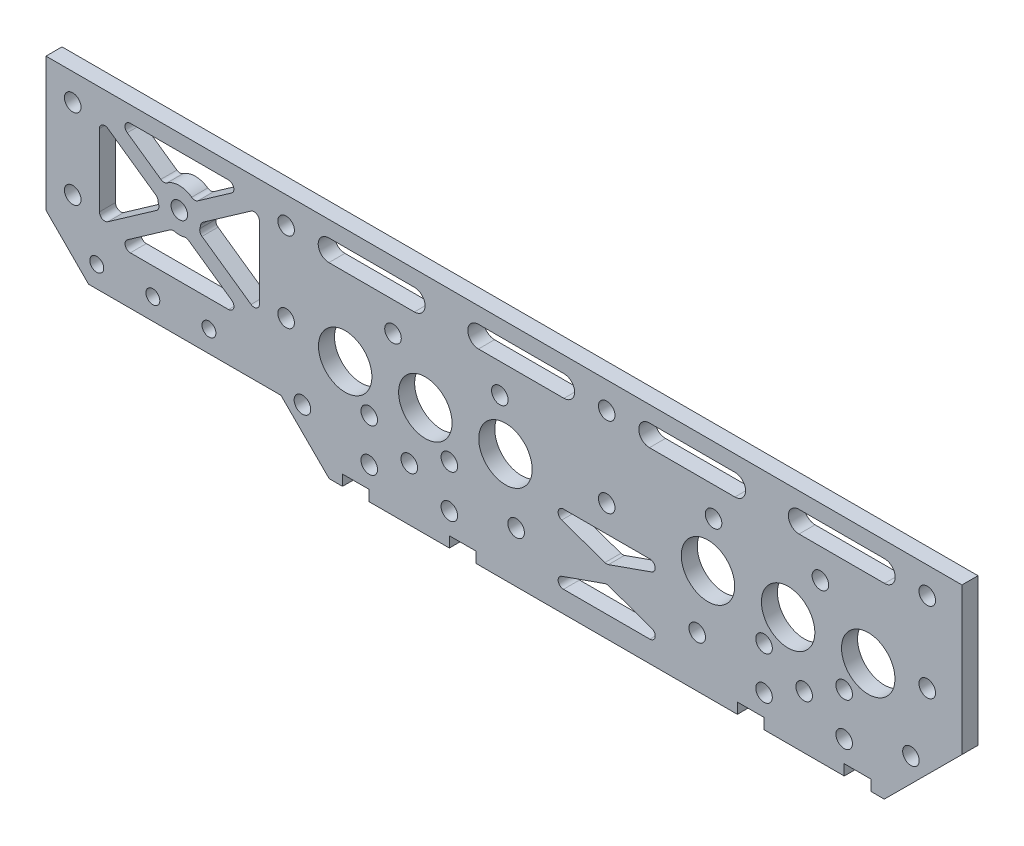
from build123d import *

# Parameters (mm, degrees)
SKETCH_1_R          = 1.55
SKETCH_1_R_2        = 1.3
EXTRUDE_1_DEPTH     = 3
FILLET_1_R          = 1
SKETCH_2_R          = 5
SKETCH_2_R_2        = 1.55
CUT_EXTRUDE_1_DEPTH = 10
SKETCH_3_W          = 5
SKETCH_3_H          = 8
CUT_EXTRUDE_2_DEPTH = 10


with BuildPart() as part:
    # 草图1 → 凸台-拉伸1 (new body)
    with BuildSketch(Plane.XY):
        Polygon((-68, 32), (103.45, 32), (103.45, 7), (103.45, 4.5), (88.907352941, -10), (86.4, -10), (-12.5, -10), (-15, -10), (-24.026470588, -1), (-60.023460411, -1), (-68, 7), align=None)
        with Locations((-7.5, 4)):
            Circle(SKETCH_1_R, mode=Mode.SUBTRACT)
        with Locations((-7.5, -4)):
            Circle(SKETCH_1_R, mode=Mode.SUBTRACT)
        with Locations((7.5, -4)):
            Circle(SKETCH_1_R, mode=Mode.SUBTRACT)
        with Locations((7.5, 4)):
            Circle(SKETCH_1_R, mode=Mode.SUBTRACT)
        with Locations((66.4, 4)):
            Circle(SKETCH_1_R, mode=Mode.SUBTRACT)
        with Locations((66.4, -4)):
            Circle(SKETCH_1_R, mode=Mode.SUBTRACT)
        with Locations((81.4, 4)):
            Circle(SKETCH_1_R, mode=Mode.SUBTRACT)
        with Locations((81.4, -4)):
            Circle(SKETCH_1_R, mode=Mode.SUBTRACT)
        with Locations((-63, 27)):
            Circle(SKETCH_1_R, mode=Mode.SUBTRACT)
        with Locations((-63, 12)):
            Circle(SKETCH_1_R, mode=Mode.SUBTRACT)
        with Locations((16.95, 19.5)):
            Circle(SKETCH_1_R, mode=Mode.SUBTRACT)
        with Locations((-3.05, 19.5)):
            Circle(SKETCH_1_R, mode=Mode.SUBTRACT)
        with Locations((-23.05, 27)):
            Circle(SKETCH_1_R, mode=Mode.SUBTRACT)
        with Locations((-23.05, 12)):
            Circle(SKETCH_1_R, mode=Mode.SUBTRACT)
        with Locations((36.95, 27)):
            Circle(SKETCH_1_R, mode=Mode.SUBTRACT)
        with Locations((36.95, 12)):
            Circle(SKETCH_1_R, mode=Mode.SUBTRACT)
        with Locations((56.95, 19.5)):
            Circle(SKETCH_1_R, mode=Mode.SUBTRACT)
        with Locations((76.95, 19.5)):
            Circle(SKETCH_1_R, mode=Mode.SUBTRACT)
        with Locations((96.95, 27)):
            Circle(SKETCH_1_R, mode=Mode.SUBTRACT)
        with Locations((96.95, 12)):
            Circle(SKETCH_1_R, mode=Mode.SUBTRACT)
        with Locations((-48, 3)):
            Circle(SKETCH_1_R_2, mode=Mode.SUBTRACT)
        with Locations((-37.5, 3)):
            Circle(SKETCH_1_R_2, mode=Mode.SUBTRACT)
        with Locations((-58.5, 3)):
            Circle(SKETCH_1_R_2, mode=Mode.SUBTRACT)
        with Locations((-43.05, 19.5)):
            Circle(SKETCH_1_R, mode=Mode.SUBTRACT)
        with Locations((93.9, -0.5)):
            Circle(SKETCH_1_R, mode=Mode.SUBTRACT)
        with Locations(Location((53.9, -0.5, 0), (0, 0, 180))):
            Circle(SKETCH_1_R, mode=Mode.SUBTRACT)
        with Locations(Location((-20, -0.5, 0), (0, 0, 180))):
            Circle(SKETCH_1_R, mode=Mode.SUBTRACT)
        with Locations((20, -0.5)):
            Circle(SKETCH_1_R, mode=Mode.SUBTRACT)
        with BuildLine():
            Line((-15.05, 29), (0.95, 29))
            ThreePointArc((0.95, 29), (2.95, 27), (0.95, 25))
            Line((0.95, 25), (-15.05, 25))
            ThreePointArc((-15.05, 25), (-17.05, 27), (-15.05, 29))
        make_face(mode=Mode.SUBTRACT)
        with BuildLine():
            Line((12.95, 29), (28.95, 29))
            ThreePointArc((28.95, 29), (30.95, 27), (28.95, 25))
            Line((28.95, 25), (12.95, 25))
            ThreePointArc((12.95, 25), (10.95, 27), (12.95, 29))
        make_face(mode=Mode.SUBTRACT)
        with BuildLine():
            Line((44.95, 29), (60.95, 29))
            ThreePointArc((60.95, 29), (62.95, 27), (60.95, 25))
            Line((60.95, 25), (44.95, 25))
            ThreePointArc((44.95, 25), (42.95, 27), (44.95, 29))
        make_face(mode=Mode.SUBTRACT)
        with BuildLine():
            Line((72.95, 29), (88.95, 29))
            ThreePointArc((88.95, 29), (90.95, 27), (88.95, 25))
            Line((88.95, 25), (72.95, 25))
            ThreePointArc((72.95, 25), (70.95, 27), (72.95, 29))
        make_face(mode=Mode.SUBTRACT)
        with BuildLine():
            Line((-30.662765464, 29), (-40.203557385, 22.310296148))
            ThreePointArc((-40.203557385, 22.310296148), (-43.03543461, 23.499973481), (-45.875900736, 22.330951259))
            Line((-45.875900736, 22.330951259), (-55.387234536, 29))
            Line((-55.387234536, 29), (-30.662765464, 29))
        make_face(mode=Mode.SUBTRACT)
        with BuildLine():
            Line((-55.387234536, 8), (-44.370821033, 15.724363392))
            ThreePointArc((-44.370821033, 15.724363392), (-43.032385745, 15.500038783), (-41.695978002, 15.736142347))
            Line((-41.695978002, 15.736142347), (-30.662765464, 8))
            Line((-30.662765464, 8), (-55.387234536, 8))
        make_face(mode=Mode.SUBTRACT)
        with BuildLine():
            Line((-58, 27.16801086), (-47.04998801, 19.490206126))
            ThreePointArc((-47.04998801, 19.490206126), (-46.950749965, 18.614477719), (-46.662143081, 17.781738565))
            Line((-46.662143081, 17.781738565), (-58, 9.83198914))
            Line((-58, 9.83198914), (-58, 27.16801086))
        make_face(mode=Mode.SUBTRACT)
        with BuildLine():
            Line((-39.425439217, 17.808090093), (-28.05, 9.83198914))
            Line((-28.05, 9.83198914), (-28.05, 27.16801086))
            Line((-28.05, 27.16801086), (-39.050253376, 19.454978443))
            ThreePointArc((-39.050253376, 19.454978443), (-39.149926133, 18.611504738), (-39.425439217, 17.808090093))
        make_face(mode=Mode.SUBTRACT)
        Polygon((23.014193592, -6), (36.95, -1.090366306), (50.885806408, -6), align=None, mode=Mode.SUBTRACT)
        Polygon((23.014193592, 7), (36.95, 2.090366306), (50.885806408, 7), align=None, mode=Mode.SUBTRACT)
    extrude(amount=EXTRUDE_1_DEPTH)

    # 圆角1
    fillet_1_edges = [part.edges().sort_by_distance(p)[0] for p in [
        (-30.662765464, 29, 1.5),
        (-55.387234536, 29, 1.5),
        (-45.875900736, 22.330951259, 1.5),
        (-40.203557385, 22.310296148, 1.5),
        (-55.387234536, 8, 1.5),
        (-30.662765464, 8, 1.5),
        (-41.695978002, 15.736142347, 1.5),
        (-44.370821033, 15.724363392, 1.5),
        (-58, 27.16801086, 1.5),
        (-58, 9.83198914, 1.5),
        (-46.662143081, 17.781738565, 1.5),
        (-47.04998801, 19.490206126, 1.5),
        (-28.05, 9.83198914, 1.5),
        (-28.05, 27.16801086, 1.5),
        (-39.050253376, 19.454978443, 1.5),
        (-39.425439217, 17.808090093, 1.5),
        (50.885806408, 7, 1.5),
        (23.014193592, 7, 1.5),
        (36.95, 2.090366306, 1.5),
        (23.014193592, -6, 1.5),
        (50.885806408, -6, 1.5),
        (36.95, -1.090366306, 1.5),
    ]]
    fillet(fillet_1_edges, radius=FILLET_1_R)

    # 草图2 → 切除-拉伸1 (cut)
    with BuildSketch(Plane.XY.offset(3)):
        with Locations((-12, 10.5)):
            Circle(SKETCH_2_R)
        with Locations((3, 10.5)):
            Circle(SKETCH_2_R)
        with Locations((18, 10.5)):
            Circle(SKETCH_2_R)
        with Locations(Location((55.907352941, 10.5, 0), (0, 0, 180))):
            Circle(SKETCH_2_R)
        with Locations(Location((70.907352941, 10.5, 0), (0, 0, 180))):
            Circle(SKETCH_2_R)
        with Locations(Location((85.907352941, 10.5, 0), (0, 0, 180))):
            Circle(SKETCH_2_R)
        Circle(SKETCH_2_R_2)
        with Locations(Location((73.907352941, 0, 0), (0, 0, 180))):
            Circle(SKETCH_2_R_2)
    extrude(amount=-CUT_EXTRUDE_1_DEPTH, mode=Mode.SUBTRACT)

    # 草图3 → 切除-拉伸2 (cut)
    with BuildSketch(Plane.XY.offset(3)):
        with Locations((-10, -12)):
            Rectangle(SKETCH_3_W, SKETCH_3_H)
        with Locations((10, -12)):
            Rectangle(SKETCH_3_W, SKETCH_3_H)
        with Locations((63.907352941, -12)):
            Rectangle(SKETCH_3_W, SKETCH_3_H)
        with Locations((83.907352941, -12)):
            Rectangle(SKETCH_3_W, SKETCH_3_H)
    extrude(amount=-CUT_EXTRUDE_2_DEPTH, mode=Mode.SUBTRACT)


solid = part.part
